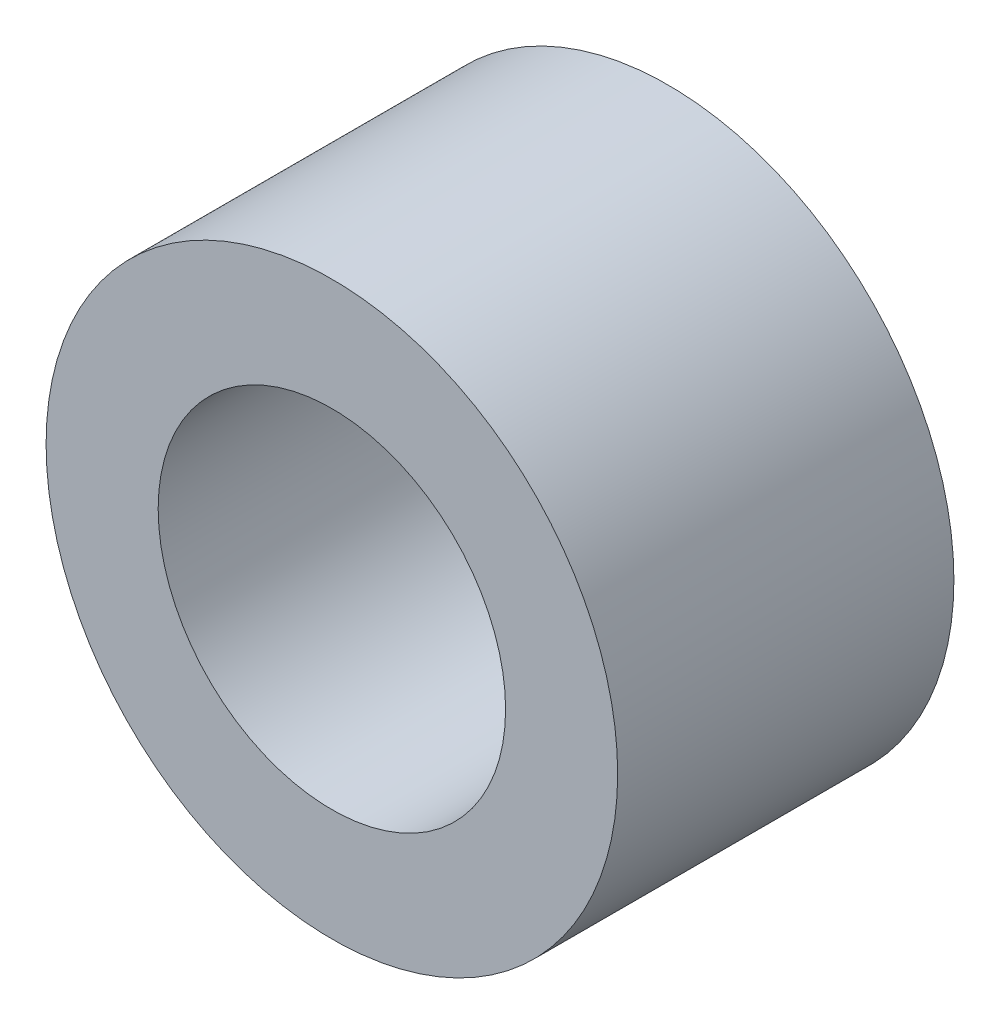
from build123d import *

# Parameters (mm, degrees)
SKETCH_1_R      = 2.55
SKETCH_1_R_2    = 1.55
EXTRUDE_1_DEPTH = 1.5


with BuildPart() as part:
    # 草图1 → 凸台-拉伸1 (new, symmetric)
    with BuildSketch(Plane.XY):
        Circle(SKETCH_1_R)
        Circle(SKETCH_1_R_2, mode=Mode.SUBTRACT)
    extrude(amount=EXTRUDE_1_DEPTH, both=True)


solid = part.part
